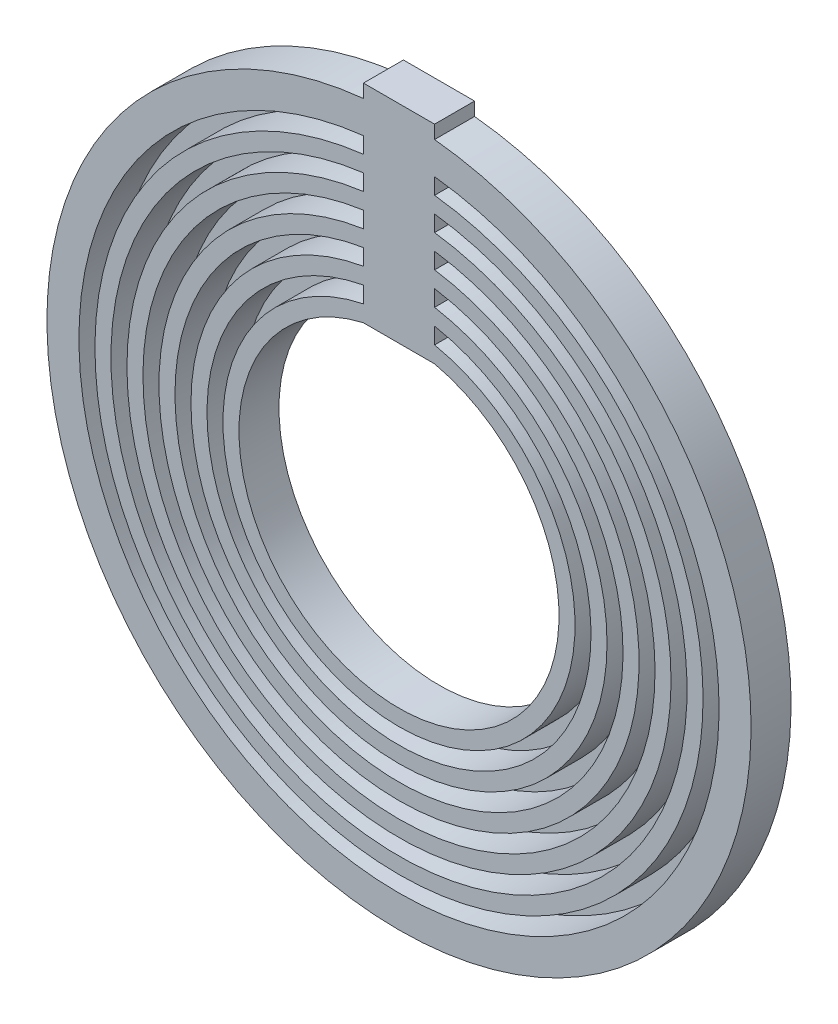
from build123d import *

# Parameters (mm, degrees)
CROQUIS1_R              = 22
CROQUIS1_R_2            = 10
SALIENTE_EXTRUIR1_DEPTH = 2.5
CROQUIS2_R              = 20
CROQUIS2_R_2            = 19
CROQUIS2_R_3            = 18
CROQUIS2_R_4            = 17
CROQUIS2_R_5            = 16
CROQUIS2_R_6            = 15
CROQUIS2_R_7            = 14
CROQUIS2_R_8            = 13
CROQUIS2_R_9            = 12
CROQUIS2_R_10           = 11
CORTAR_EXTRUIR1_DEPTH   = 2.25
SALIENTE_EXTRUIR2_DEPTH = 2.5


with BuildPart() as part:
    # Croquis1 → Saliente-Extruir1 (new body)
    with BuildSketch(Plane.XY):
        Circle(CROQUIS1_R)
        Circle(CROQUIS1_R_2, mode=Mode.SUBTRACT)
    extrude(amount=SALIENTE_EXTRUIR1_DEPTH)

    # Croquis2 → Cortar-Extruir1 (cut)
    # profile 1 of 5: a face of its own
    with BuildSketch(Plane.XY.offset(2.5)):
        Circle(CROQUIS2_R)
        Circle(CROQUIS2_R_2, mode=Mode.SUBTRACT)
    # profile 2 of 5: a face of its own
    with BuildSketch(Plane.XY.offset(2.5)):
        Circle(CROQUIS2_R_3)
        Circle(CROQUIS2_R_4, mode=Mode.SUBTRACT)
    # profile 3 of 5: a face of its own
    with BuildSketch(Plane.XY.offset(2.5)):
        Circle(CROQUIS2_R_5)
        Circle(CROQUIS2_R_6, mode=Mode.SUBTRACT)
    # profile 4 of 5: a face of its own
    with BuildSketch(Plane.XY.offset(2.5)):
        Circle(CROQUIS2_R_7)
        Circle(CROQUIS2_R_8, mode=Mode.SUBTRACT)
    # profile 5 of 5: a face of its own
    with BuildSketch(Plane.XY.offset(2.5)):
        Circle(CROQUIS2_R_9)
        Circle(CROQUIS2_R_10, mode=Mode.SUBTRACT)
    extrude(amount=-CORTAR_EXTRUIR1_DEPTH, mode=Mode.SUBTRACT)

    # Croquis3 → Saliente-Extruir2 (add)
    with BuildSketch(Plane.XY.offset(2.5)):
        with BuildLine():
            ThreePointArc((2.222048604, 9.75), (0, 10), (-2.222048604, 9.75))
            Line((-2.222048604, 9.75), (2.222048604, 9.75))
        make_face()
        with BuildLine():
            ThreePointArc((-2.222048604, 10.773230713), (0, 11), (2.222048604, 10.773230713))
            Line((2.222048604, 10.773230713), (2.222048604, 11.792476415))
            ThreePointArc((2.222048604, 11.792476415), (0, 12), (-2.222048604, 11.792476415))
            Line((-2.222048604, 11.792476415), (-2.222048604, 10.773230713))
        make_face()
        with BuildLine():
            ThreePointArc((-2.222048604, 12.808688457), (0, 13), (2.222048604, 12.808688457))
            Line((2.222048604, 12.808688457), (2.222048604, 13.822535947))
            ThreePointArc((2.222048604, 13.822535947), (0, 14), (-2.222048604, 13.822535947))
            Line((-2.222048604, 13.822535947), (-2.222048604, 12.808688457))
        make_face()
        with BuildLine():
            ThreePointArc((-2.222048604, 14.834503699), (0, 15), (2.222048604, 14.834503699))
            Line((2.222048604, 14.834503699), (2.222048604, 15.844951877))
            ThreePointArc((2.222048604, 15.844951877), (0, 16), (-2.222048604, 15.844951877))
            Line((-2.222048604, 15.844951877), (-2.222048604, 14.834503699))
        make_face()
        with BuildLine():
            ThreePointArc((-2.222048604, 16.854153791), (0, 17), (2.222048604, 16.854153791))
            Line((2.222048604, 16.854153791), (2.222048604, 17.862320678))
            ThreePointArc((2.222048604, 17.862320678), (0, 18), (-2.222048604, 17.862320678))
            Line((-2.222048604, 17.862320678), (-2.222048604, 16.854153791))
        make_face()
        with BuildLine():
            ThreePointArc((-2.222048604, 18.869618438), (0, 19), (2.222048604, 18.869618438))
            Line((2.222048604, 18.869618438), (2.222048604, 19.87617921))
            ThreePointArc((2.222048604, 19.87617921), (0, 20), (-2.222048604, 19.87617921))
            Line((-2.222048604, 19.87617921), (-2.222048604, 18.869618438))
        make_face()
        with BuildLine():
            ThreePointArc((-2.222048604, 21.887496431), (0, 22), (2.222048604, 21.887496431))
            Line((2.222048604, 21.887496431), (2.222048604, 22.721977181))
            Line((2.222048604, 22.721977181), (-2.222048604, 22.721977181))
            Line((-2.222048604, 22.721977181), (-2.222048604, 21.887496431))
        make_face()
    extrude(amount=-SALIENTE_EXTRUIR2_DEPTH)


solid = part.part
